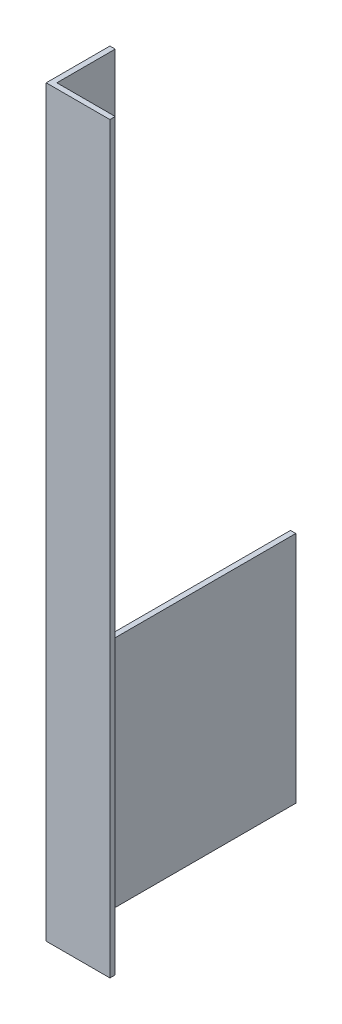
from build123d import *

# Parameters (mm, degrees)
BOSS_EXTRUDE1_DEPTH = 222.25
SKETCH19_W          = 107.95
SKETCH19_H          = 139.7
BOSS_EXTRUDE2_DEPTH = 3.175


with BuildPart() as part:
    # Sketch18 → Boss-Extrude1 (new, symmetric)
    with BuildSketch(Plane(origin=(0, 0, 0), x_dir=(1, 0, 0), z_dir=(0, 1, 0))):
        Polygon((3.175, 38.1), (3.175, 3.175), (38.1, 3.175), (38.1, 0), (0, 0), (0, 38.1), align=None)
    extrude(amount=BOSS_EXTRUDE1_DEPTH, both=True)

    # Sketch19 → Boss-Extrude2 (add)
    with BuildSketch(Plane(origin=(0, 0, 0), x_dir=(0, 0, -1), z_dir=(1, 0, 0))):
        with Locations((92.075, -152.4)):
            Rectangle(SKETCH19_W, SKETCH19_H)
    extrude(amount=BOSS_EXTRUDE2_DEPTH)


solid = part.part
